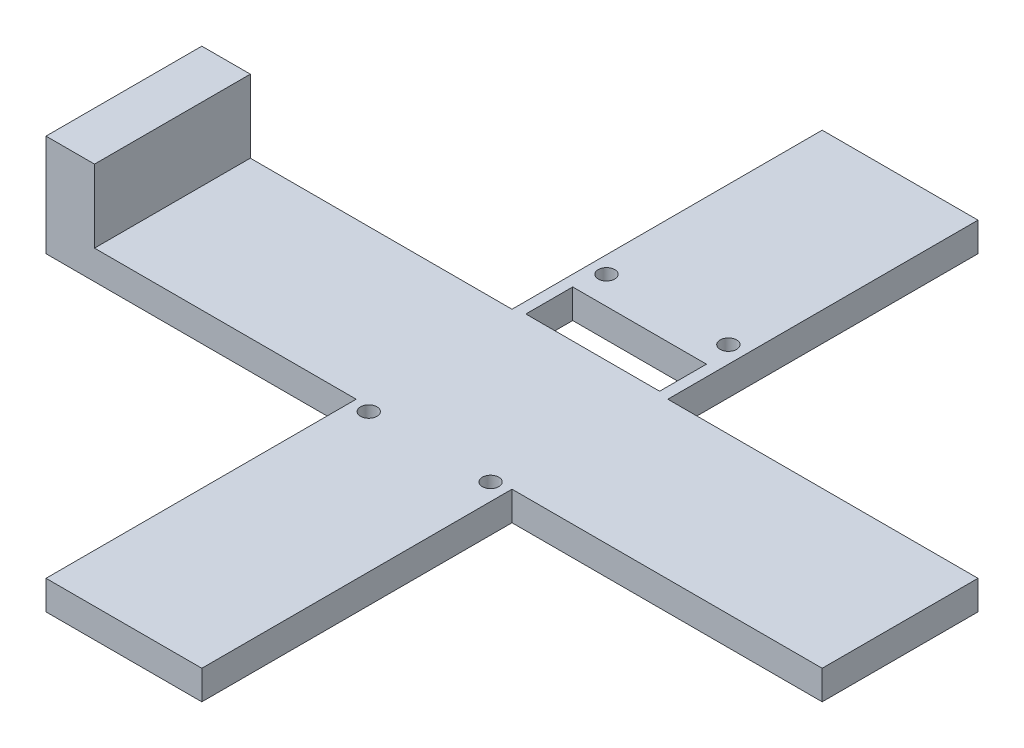
from build123d import *

# Parameters (mm, degrees)
SKETCH21_R           = 1.7
SKETCH21_W           = 27.57
SKETCH21_H           = 9.66
BOSS_EXTRUDE18_DEPTH = 6
SKETCH22_W           = 10
SKETCH22_H           = 32.12
BOSS_EXTRUDE19_DEPTH = 15


with BuildPart() as part:
    # Sketch21 → Boss-Extrude18 (new body)
    with BuildSketch(Plane(origin=(0, 0, 0), x_dir=(1, 0, 0), z_dir=(0, 1, 0))):
        Polygon((0, 84), (-16.06, 84), (-16.06, 20.06), (-80, 20.06), (-80, 4), (-80, -12.06), (-16.06, -12.06), (-16.06, -76), (0, -76), (16.06, -76), (16.06, -12.06), (80, -12.06), (80, 4), (80, 20.06), (16.06, 20.06), (16.06, 84), align=None)
        with Locations(Location((-12.56, 36.04, 0), (0, 0, 270))):
            Circle(SKETCH21_R, mode=Mode.SUBTRACT)
        with Locations(Location((12.56, 36.04, 0), (0, 0, 270))):
            Circle(SKETCH21_R, mode=Mode.SUBTRACT)
        with Locations(Location((12.56, -12.97, 0), (0, 0, 270))):
            Circle(SKETCH21_R, mode=Mode.SUBTRACT)
        with Locations(Location((-12.56, -12.97, 0), (0, 0, 270))):
            Circle(SKETCH21_R, mode=Mode.SUBTRACT)
        with Locations((0, 25.47)):
            Rectangle(SKETCH21_W, SKETCH21_H, mode=Mode.SUBTRACT)
    extrude(amount=BOSS_EXTRUDE18_DEPTH)

    # Sketch22 → Boss-Extrude19 (add)
    with BuildSketch(Plane(origin=(0, 6, 0), x_dir=(1, 0, 0), z_dir=(0, 1, 0))):
        with Locations((-75, 4)):
            Rectangle(SKETCH22_W, SKETCH22_H)
    extrude(amount=BOSS_EXTRUDE19_DEPTH)


solid = part.part
